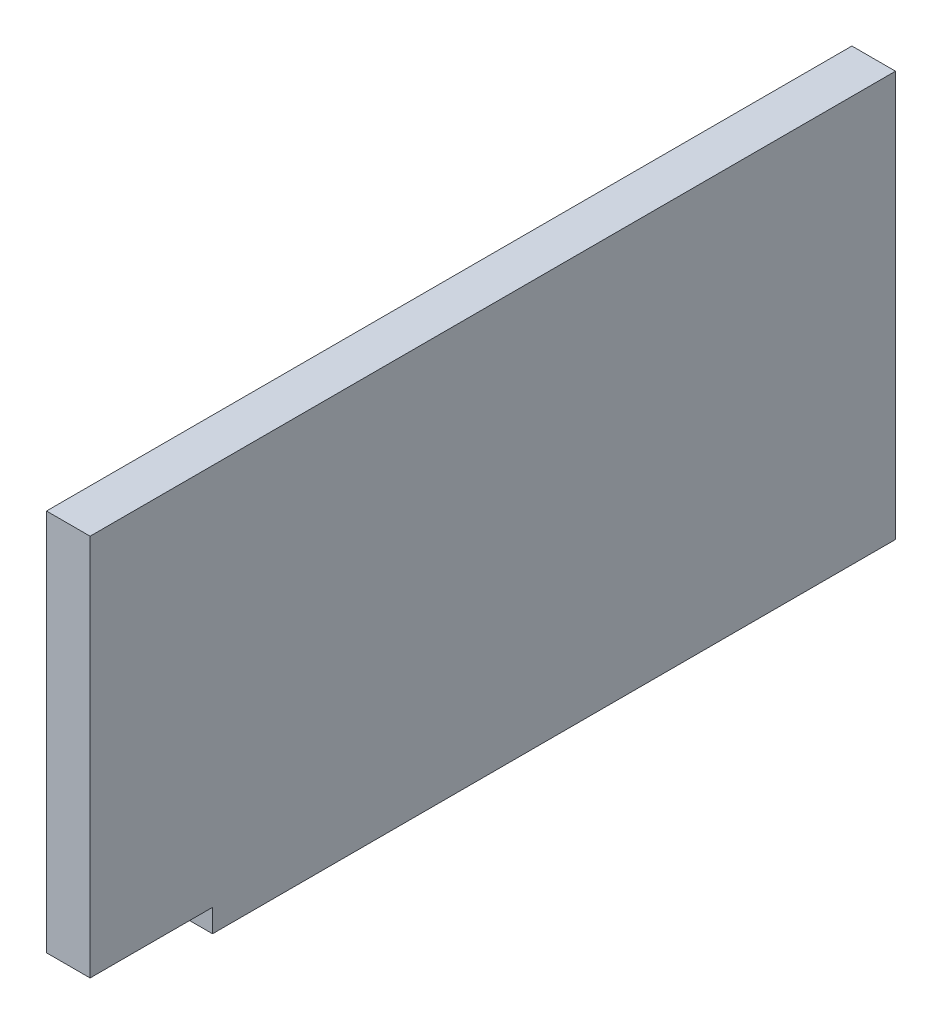
from build123d import *

# Parameters (mm, degrees)
BOSS_EXTRUDE1_DEPTH      = 2.85
BOSS_EXTRUDE1_DEPTH_BACK = 2.85
SKETCH1_W                = 105.25
SKETCH1_H                = 53
SKETCH2_W                = 16
SKETCH2_H                = 3
CUT_EXTRUDE1_DEPTH       = 60.19569769


with BuildPart() as part:
    # Sketch1 → Boss-Extrude1 (new, two sides: drawn at the far end of the back side and taken through both)
    with BuildSketch(Plane(origin=(0, 0, 0), x_dir=(0, 0, -1), z_dir=(1, 0, 0)).offset(-BOSS_EXTRUDE1_DEPTH_BACK)):
        Rectangle(SKETCH1_W, SKETCH1_H)
    extrude(amount=BOSS_EXTRUDE1_DEPTH + BOSS_EXTRUDE1_DEPTH_BACK)

    # Sketch2 → Cut-Extrude1 (cut, through all)
    with BuildSketch(Plane(origin=(2.85, 0, 0), x_dir=(0, 0, -1), z_dir=(1, 0, 0))):
        with Locations((-44.625, -25)):
            Rectangle(SKETCH2_W, SKETCH2_H)
    extrude(amount=-CUT_EXTRUDE1_DEPTH, mode=Mode.SUBTRACT)


solid = part.part
